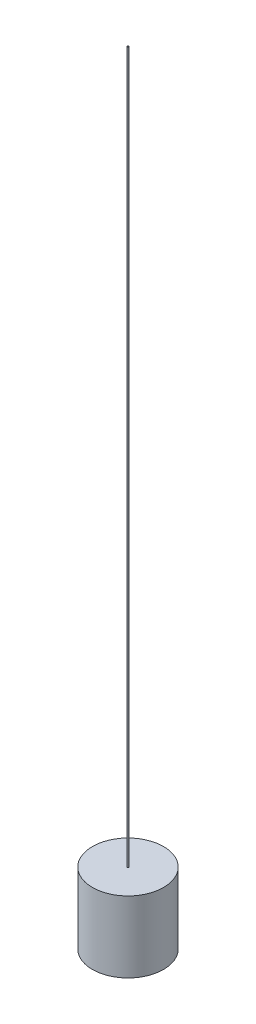
from build123d import *

# Parameters (mm, degrees)
SKETCH_1_W   = 500
SKETCH_1_H   = 1000
SKETCH_1_W_2 = 10
SKETCH_1_H_2 = 10000


with BuildPart() as part:
    # ｽｹｯﾁ1 → 回転1 (revolve)
    with BuildSketch(Plane.XY, mode=Mode.PRIVATE) as revolve_1_sk:
        with Locations((-250, -500)):
            Rectangle(SKETCH_1_W, SKETCH_1_H)
        with Locations((-5, 5000)):
            Rectangle(SKETCH_1_W_2, SKETCH_1_H_2)
    revolve(revolve_1_sk.sketch.rotate(Axis((0, 0, 0), (0, -1, 0)), 270), axis=Axis((0, 0, 0), (0, -1, 0)))


solid = part.part
